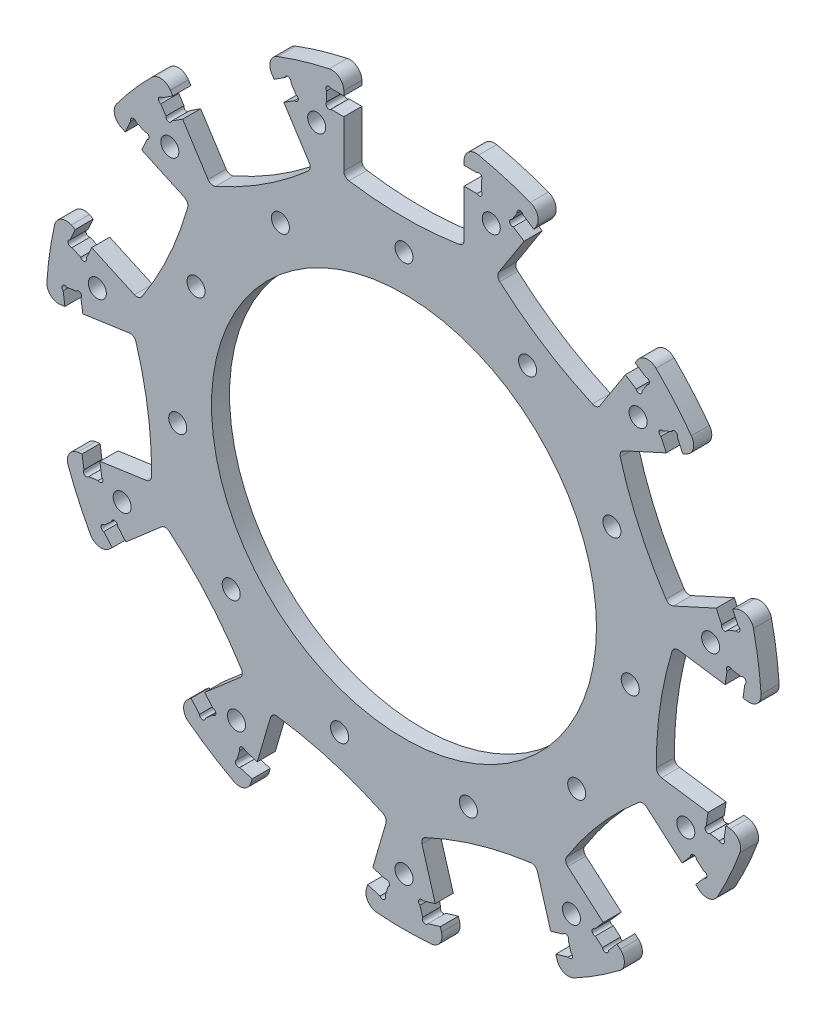
from build123d import *

# Parameters (mm, degrees)
SKETCH_2_R          = 32
SKETCH_2_R_2        = 1.5
EXTRUDE_1_DEPTH     = 1.5
FILLET_1_R          = 1
FILLET_2_R          = 2
SKETCH_3_W          = 2.85
SKETCH_3_H          = 3
CUT_EXTRUDE_1_DEPTH = 85.106848548
SKETCH_4_R          = 0.5
CUT_EXTRUDE_2_DEPTH = 85.106848548


with BuildPart() as part:
    # 草图2 → 凸台-拉伸1 (new, symmetric)
    with BuildSketch(Plane.XY):
        with BuildLine():
            Line((10, 58.653644388), (10, 43.839202169))
            ThreePointArc((10, 43.839202169), (0, 43), (-10, 43.839202169))
            Line((-10, 43.839202169), (-10, 58.653644388))
            ThreePointArc((-10, 58.653644388), (-16.763087132, 57.08983193), (-23.29801892, 54.748993729))
            Line((-23.29801892, 54.748993729), (-15.288726769, 42.286291876))
            ThreePointArc((-15.288726769, 42.286291876), (-23.247555151, 36.173901912), (-32.113797426, 31.473475527))
            Line((-32.113797426, 31.473475527), (-40.123089577, 43.93617738))
            ThreePointArc((-40.123089577, 43.93617738), (-44.967099674, 38.96421367), (-49.199081449, 33.4619244))
            Line((-49.199081449, 33.4619244), (-35.723390814, 27.307782693))
            ThreePointArc((-35.723390814, 27.307782693), (-39.1141758, 17.862845559), (-44.031691074, 9.115142785))
            Line((-44.031691074, 9.115142785), (-57.50738171, 15.269284493))
            ThreePointArc((-57.50738171, 15.269284493), (-58.894375792, 8.467732877), (-59.479783242, 1.550930504))
            Line((-59.479783242, 1.550930504), (-44.816130685, 3.659245452))
            ThreePointArc((-44.816130685, 3.659245452), (-42.562322001, -6.119538046), (-41.969833919, -16.137183386))
            Line((-41.969833919, -16.137183386), (-56.633486477, -18.245498334))
            ThreePointArc((-56.633486477, -18.245498334), (-54.123103724, -24.717193274), (-50.87607412, -30.852472869))
            Line((-50.87607412, -30.852472869), (-39.680065719, -21.151076364))
            ThreePointArc((-39.680065719, -21.151076364), (-32.497231697, -28.15901156), (-26.58285104, -36.266067852))
            Line((-26.58285104, -36.266067852), (-37.778859441, -45.967464356))
            ThreePointArc((-37.778859441, -45.967464356), (-32.168128639, -50.054585203), (-26.119570938, -53.460434099))
            Line((-26.119570938, -53.460434099), (-21.945860253, -39.246080882))
            ThreePointArc((-21.945860253, -39.246080882), (-12.114499944, -41.258197865), (-2.756000781, -44.880732018))
            Line((-2.756000781, -44.880732018), (-6.929711465, -59.095085236))
            ThreePointArc((-6.929711465, -59.095085236), (0, -59.5), (6.929711465, -59.095085236))
            Line((6.929711465, -59.095085236), (2.756000781, -44.880732018))
            ThreePointArc((2.756000781, -44.880732018), (12.114499944, -41.258197865), (21.945860253, -39.246080882))
            Line((21.945860253, -39.246080882), (26.119570938, -53.460434099))
            ThreePointArc((26.119570938, -53.460434099), (32.168128639, -50.054585203), (37.778859441, -45.967464356))
            Line((37.778859441, -45.967464356), (26.58285104, -36.266067852))
            ThreePointArc((26.58285104, -36.266067852), (32.497231697, -28.15901156), (39.680065719, -21.151076364))
            Line((39.680065719, -21.151076364), (50.87607412, -30.852472869))
            ThreePointArc((50.87607412, -30.852472869), (54.123103724, -24.717193274), (56.633486477, -18.245498334))
            Line((56.633486477, -18.245498334), (41.969833919, -16.137183386))
            ThreePointArc((41.969833919, -16.137183386), (42.562322001, -6.119538046), (44.816130685, 3.659245452))
            Line((44.816130685, 3.659245452), (59.479783242, 1.550930504))
            ThreePointArc((59.479783242, 1.550930504), (58.894375792, 8.467732877), (57.50738171, 15.269284493))
            Line((57.50738171, 15.269284493), (44.031691074, 9.115142785))
            ThreePointArc((44.031691074, 9.115142785), (39.1141758, 17.862845559), (35.723390814, 27.307782693))
            Line((35.723390814, 27.307782693), (49.199081449, 33.4619244))
            ThreePointArc((49.199081449, 33.4619244), (44.967099674, 38.96421367), (40.123089577, 43.93617738))
            Line((40.123089577, 43.93617738), (32.113797426, 31.473475527))
            ThreePointArc((32.113797426, 31.473475527), (23.247555151, 36.173901912), (15.288726769, 42.286291876))
            Line((15.288726769, 42.286291876), (23.29801892, 54.748993729))
            ThreePointArc((23.29801892, 54.748993729), (16.763087132, 57.08983193), (10, 58.653644388))
        make_face()
        Circle(SKETCH_2_R, mode=Mode.SUBTRACT)
        with Locations((0, -51.5)):
            Circle(SKETCH_2_R_2, mode=Mode.SUBTRACT)
        with Locations((-27.843002099, -43.324556941)):
            Circle(SKETCH_2_R_2, mode=Mode.SUBTRACT)
        with Locations((-46.846047761, -21.39387317)):
            Circle(SKETCH_2_R_2, mode=Mode.SUBTRACT)
        with Locations((-50.975804257, 7.329214171)):
            Circle(SKETCH_2_R_2, mode=Mode.SUBTRACT)
        with Locations((-38.921103079, 33.725327798)):
            Circle(SKETCH_2_R_2, mode=Mode.SUBTRACT)
        with Locations((-14.509226677, 49.413888141)):
            Circle(SKETCH_2_R_2, mode=Mode.SUBTRACT)
        with Locations((14.509226677, 49.413888141)):
            Circle(SKETCH_2_R_2, mode=Mode.SUBTRACT)
        with Locations((38.921103079, 33.725327798)):
            Circle(SKETCH_2_R_2, mode=Mode.SUBTRACT)
        with Locations((50.975804257, 7.329214171)):
            Circle(SKETCH_2_R_2, mode=Mode.SUBTRACT)
        with Locations((46.846047761, -21.39387317)):
            Circle(SKETCH_2_R_2, mode=Mode.SUBTRACT)
        with Locations((27.843002099, -43.324556941)):
            Circle(SKETCH_2_R_2, mode=Mode.SUBTRACT)
        with Locations((0, 38)):
            Circle(SKETCH_2_R_2, mode=Mode.SUBTRACT)
        with Locations((20.544351063, 31.967634248)):
            Circle(SKETCH_2_R_2, mode=Mode.SUBTRACT)
        with Locations((34.566015823, 15.785770494)):
            Circle(SKETCH_2_R_2, mode=Mode.SUBTRACT)
        with Locations((37.613214791, -5.407963854)):
            Circle(SKETCH_2_R_2, mode=Mode.SUBTRACT)
        with Locations((28.718483825, -24.88470789)):
            Circle(SKETCH_2_R_2, mode=Mode.SUBTRACT)
        with Locations((10.70583716, -36.460732997)):
            Circle(SKETCH_2_R_2, mode=Mode.SUBTRACT)
        with Locations((-10.70583716, -36.460732997)):
            Circle(SKETCH_2_R_2, mode=Mode.SUBTRACT)
        with Locations((-28.718483825, -24.88470789)):
            Circle(SKETCH_2_R_2, mode=Mode.SUBTRACT)
        with Locations((-37.613214791, -5.407963854)):
            Circle(SKETCH_2_R_2, mode=Mode.SUBTRACT)
        with Locations((-34.566015823, 15.785770494)):
            Circle(SKETCH_2_R_2, mode=Mode.SUBTRACT)
        with Locations((-20.544351063, 31.967634248)):
            Circle(SKETCH_2_R_2, mode=Mode.SUBTRACT)
    extrude(amount=EXTRUDE_1_DEPTH, both=True)

    # 圆角1
    fillet_1_edges = [part.edges().sort_by_distance(p)[0] for p in [
        (10, 43.839202169, 0),
        (-10, 43.839202169, 0),
        (-15.288726769, 42.286291876, 0),
        (-32.113797426, 31.473475527, 0),
        (-35.723390814, 27.307782693, 0),
        (-44.031691074, 9.115142785, 0),
        (-44.816130685, 3.659245452, 0),
        (-41.969833919, -16.137183386, 0),
        (-39.680065719, -21.151076364, 0),
        (-26.58285104, -36.266067852, 0),
        (-21.945860253, -39.246080882, 0),
        (-2.756000781, -44.880732018, 0),
        (2.756000781, -44.880732018, 0),
        (21.945860253, -39.246080882, 0),
        (26.58285104, -36.266067852, 0),
        (39.680065719, -21.151076364, 0),
        (41.969833919, -16.137183386, 0),
        (44.816130685, 3.659245452, 0),
        (44.031691074, 9.115142785, 0),
        (35.723390814, 27.307782693, 0),
        (32.113797426, 31.473475527, 0),
        (15.288726769, 42.286291876, 0),
    ]]
    fillet(fillet_1_edges, radius=FILLET_1_R)

    # 圆角2
    fillet_2_edges = [part.edges().sort_by_distance(p)[0] for p in [
        (10, 58.653644388, 0),
        (-10, 58.653644388, 0),
        (-23.29801892, 54.748993729, 0),
        (-40.123089577, 43.93617738, 0),
        (-49.199081449, 33.4619244, 0),
        (-57.50738171, 15.269284493, 0),
        (-59.479783242, 1.550930504, 0),
        (-56.633486477, -18.245498334, 0),
        (-50.87607412, -30.852472869, 0),
        (-37.778859441, -45.967464356, 0),
        (-26.119570938, -53.460434099, 0),
        (-6.929711465, -59.095085236, 0),
        (6.929711465, -59.095085236, 0),
        (26.119570938, -53.460434099, 0),
        (37.778859441, -45.967464356, 0),
        (50.87607412, -30.852472869, 0),
        (56.633486477, -18.245498334, 0),
        (59.479783242, 1.550930504, 0),
        (57.50738171, 15.269284493, 0),
        (49.199081449, 33.4619244, 0),
        (40.123089577, 43.93617738, 0),
        (23.29801892, 54.748993729, 0),
    ]]
    fillet(fillet_2_edges, radius=FILLET_2_R)

    # 草图3 → 切除-拉伸1 (cut, through all)
    with BuildSketch(Plane.XY.offset(1.5)):
        with Locations((-11.425, 54)):
            Rectangle(SKETCH_3_W, SKETCH_3_H)
        with Locations((11.425, 54)):
            Rectangle(SKETCH_3_W, SKETCH_3_H)
        Polygon((19.971107588, 49.572218648), (17.57353502, 51.113044978), (19.195457472, 53.636805576), (21.59303004, 52.095979247), align=None)
        Polygon((38.418100697, 41.283162898), (40.815673266, 39.742336568), (39.193750813, 37.218575969), (36.796178245, 38.759402299), align=None)
        Polygon((43.601529626, 30.905608136), (42.417596839, 33.498059323), (45.146492825, 34.744304362), (46.330425612, 32.151853175), align=None)
        Polygon((54.638725872, 13.959213268), (55.822658659, 11.366762081), (53.093762673, 10.120517042), (51.909829886, 12.712968229), align=None)
        Polygon((53.388774081, 2.426685409), (53.794371371, 5.247676519), (56.763835696, 4.820732004), (56.358238407, 1.999740895), align=None)
        Polygon((53.511941642, -17.796687943), (53.106344353, -20.617679052), (50.136880027, -20.190734538), (50.542477316, -17.369743428), align=None)
        Polygon((46.225459993, -26.822692789), (48.091813085, -24.668806502), (50.359061808, -26.633388704), (48.492708716, -28.78727499), align=None)
        Polygon((35.395494037, -43.902266478), (33.529140945, -46.056152764), (31.261892222, -44.091570563), (33.128245314, -41.937684276), align=None)
        Polygon((24.38588897, -47.556055546), (27.120443945, -46.753117759), (27.965641616, -49.63159668), (25.231086641, -50.434534467), align=None)
        Polygon((6.041227169, -56.069185604), (3.306672194, -56.872123391), (2.461474523, -53.99364447), (5.196029498, -53.190706683), align=None)
        Polygon((-5.196029498, -53.190706683), (-2.461474523, -53.99364447), (-3.306672194, -56.872123391), (-6.041227169, -56.069185604), align=None)
        Polygon((-25.231086641, -50.434534467), (-27.965641616, -49.63159668), (-27.120443945, -46.753117759), (-24.38588897, -47.556055546), align=None)
        Polygon((-33.128245314, -41.937684276), (-31.261892222, -44.091570563), (-33.529140945, -46.056152764), (-35.395494037, -43.902266478), align=None)
        Polygon((-48.492708716, -28.78727499), (-50.359061808, -26.633388704), (-48.091813085, -24.668806502), (-46.225459993, -26.822692789), align=None)
        Polygon((-50.542477316, -17.369743428), (-50.136880027, -20.190734538), (-53.106344353, -20.617679052), (-53.511941642, -17.796687943), align=None)
        Polygon((-56.358238407, 1.999740895), (-56.763835696, 4.820732004), (-53.794371371, 5.247676519), (-53.388774081, 2.426685409), align=None)
        Polygon((-51.909829886, 12.712968229), (-53.093762673, 10.120517042), (-55.822658659, 11.366762081), (-54.638725872, 13.959213268), align=None)
        Polygon((-46.330425612, 32.151853175), (-45.146492825, 34.744304362), (-42.417596839, 33.498059323), (-43.601529626, 30.905608136), align=None)
        Polygon((-36.796178245, 38.759402299), (-39.193750813, 37.218575969), (-40.815673266, 39.742336568), (-38.418100697, 41.283162898), align=None)
        Polygon((-21.59303004, 52.095979247), (-19.195457472, 53.636805576), (-17.57353502, 51.113044978), (-19.971107588, 49.572218648), align=None)
    extrude(amount=-CUT_EXTRUDE_1_DEPTH, mode=Mode.SUBTRACT)

    # 草图4 → 切除-拉伸2 (cut, through all)
    with BuildSketch(Plane.XY.offset(1.5)):
        with Locations((12.496446609, 55.146446609)):
            Circle(SKETCH_4_R)
        with Locations((12.496446609, 52.853553391)):
            Circle(SKETCH_4_R)
        with Locations((-12.496446609, 55.146446609)):
            Circle(SKETCH_4_R)
        with Locations((-12.496446609, 52.853553391)):
            Circle(SKETCH_4_R)
        with Locations((19.301740117, 53.148232143)):
            Circle(SKETCH_4_R)
        with Locations((18.062108453, 51.219327623)):
            Circle(SKETCH_4_R)
        with Locations((40.327099833, 39.636053923)):
            Circle(SKETCH_4_R)
        with Locations((39.087468169, 37.707149402)):
            Circle(SKETCH_4_R)
        with Locations((44.971760735, 34.275829499)):
            Circle(SKETCH_4_R)
        with Locations((42.886071702, 33.323327233)):
            Circle(SKETCH_4_R)
        with Locations((55.354183797, 11.541494171)):
            Circle(SKETCH_4_R)
        with Locations((53.268494763, 10.588991905)):
            Circle(SKETCH_4_R)
        with Locations((56.363565076, 4.521093171)):
            Circle(SKETCH_4_R)
        with Locations((54.094010204, 4.847405898)):
            Circle(SKETCH_4_R)
        with Locations((52.806705519, -20.217408432)):
            Circle(SKETCH_4_R)
        with Locations((50.537150647, -19.891095704)):
            Circle(SKETCH_4_R)
        with Locations((49.860335751, -26.669058295)):
            Circle(SKETCH_4_R)
        with Locations((48.127482676, -25.167532559)):
            Circle(SKETCH_4_R)
        with Locations((33.493471354, -45.557426707)):
            Circle(SKETCH_4_R)
        with Locations((31.76061828, -44.055900971)):
            Circle(SKETCH_4_R)
        with Locations((27.526802121, -49.391972187)):
            Circle(SKETCH_4_R)
        with Locations((26.880819452, -47.191957254)):
            Circle(SKETCH_4_R)
        with Locations((3.546296687, -56.433283896)):
            Circle(SKETCH_4_R)
        with Locations((2.900314018, -54.233268964)):
            Circle(SKETCH_4_R)
        with Locations((-3.546296687, -56.433283896)):
            Circle(SKETCH_4_R)
        with Locations((-2.900314018, -54.233268964)):
            Circle(SKETCH_4_R)
        with Locations((-27.526802121, -49.391972187)):
            Circle(SKETCH_4_R)
        with Locations((-26.880819452, -47.191957254)):
            Circle(SKETCH_4_R)
        with Locations((-33.493471354, -45.557426707)):
            Circle(SKETCH_4_R)
        with Locations((-31.76061828, -44.055900971)):
            Circle(SKETCH_4_R)
        with Locations((-49.860335751, -26.669058295)):
            Circle(SKETCH_4_R)
        with Locations((-48.127482676, -25.167532559)):
            Circle(SKETCH_4_R)
        with Locations((-52.806705519, -20.217408432)):
            Circle(SKETCH_4_R)
        with Locations((-50.537150647, -19.891095704)):
            Circle(SKETCH_4_R)
        with Locations((-56.363565076, 4.521093171)):
            Circle(SKETCH_4_R)
        with Locations((-54.094010204, 4.847405898)):
            Circle(SKETCH_4_R)
        with Locations((-55.354183797, 11.541494171)):
            Circle(SKETCH_4_R)
        with Locations((-53.268494763, 10.588991905)):
            Circle(SKETCH_4_R)
        with Locations((-44.971760735, 34.275829499)):
            Circle(SKETCH_4_R)
        with Locations((-42.886071702, 33.323327233)):
            Circle(SKETCH_4_R)
        with Locations((-40.327099833, 39.636053923)):
            Circle(SKETCH_4_R)
        with Locations((-39.087468169, 37.707149402)):
            Circle(SKETCH_4_R)
        with Locations((-19.301740117, 53.148232143)):
            Circle(SKETCH_4_R)
        with Locations((-18.062108453, 51.219327623)):
            Circle(SKETCH_4_R)
    extrude(amount=-CUT_EXTRUDE_2_DEPTH, mode=Mode.SUBTRACT)


solid = part.part
